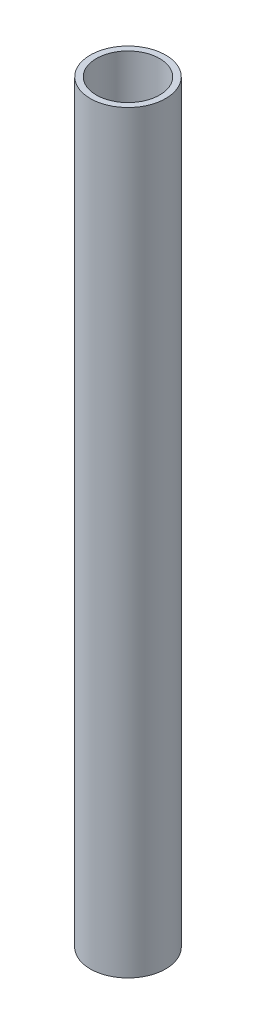
from build123d import *

# Parameters (mm, degrees)
CROQUIS1_R              = 12.5
CROQUIS1_R_2            = 10.5
SALIENTE_EXTRUIR1_DEPTH = 250


with BuildPart() as part:
    # Croquis1 → Saliente-Extruir1 (new body)
    with BuildSketch(Plane(origin=(0, 0, 0), x_dir=(1, 0, 0), z_dir=(0, 1, 0))):
        with Locations(Location((0, 0, 0), (0, 0, 270))):
            Circle(CROQUIS1_R)
        with Locations(Location((0, 0, 0), (0, 0, 270))):
            Circle(CROQUIS1_R_2, mode=Mode.SUBTRACT)
    extrude(amount=SALIENTE_EXTRUIR1_DEPTH)


solid = part.part
